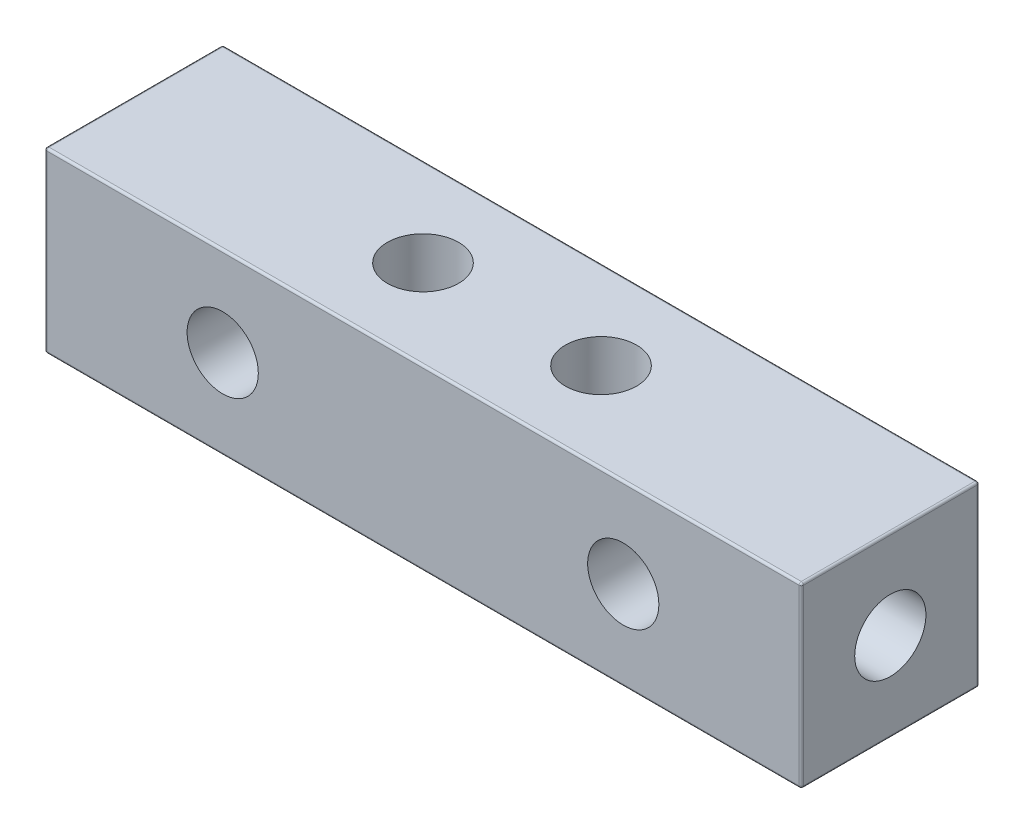
from build123d import *

# Parameters (mm, degrees)
SKETCH_1_W          = 8
SKETCH_1_H          = 8
EXTRUDE_1_DEPTH     = 34
FILLET_1_R          = 0.1
SKETCH_2_R          = 1.6
CUT_EXTRUDE_1_DEPTH = 35.467375879
SKETCH_3_R          = 1.6
CUT_EXTRUDE_2_DEPTH = 36.156791662
SKETCH_4_R          = 1.6
CUT_EXTRUDE_3_DEPTH = 36.156791662


with BuildPart() as part:
    # 草图1 → 凸台-拉伸1 (new body)
    with BuildSketch(Plane(origin=(0, 0, 0), x_dir=(0, 0, -1), z_dir=(1, 0, 0))):
        Rectangle(SKETCH_1_W, SKETCH_1_H)
    extrude(amount=EXTRUDE_1_DEPTH)

    # 圆角1
    fillet_1_edges = [part.edges().sort_by_distance(p)[0] for p in [
        (34, 0, 4),
        (34, -4, 0),
        (34, 0, -4),
        (0, -4, 0),
        (0, 0, 4),
        (0, 4, 0),
        (0, 0, -4),
        (17, -4, -4),
        (17, -4, 4),
        (17, 4, 4),
        (17, 4, -4),
        (34, 4, 0),
    ]]
    fillet(fillet_1_edges, radius=FILLET_1_R)

    # 草图2 → 切除-拉伸1 (cut, through all)
    with BuildSketch(Plane.ZY):
        Circle(SKETCH_2_R)
    extrude(amount=-CUT_EXTRUDE_1_DEPTH, mode=Mode.SUBTRACT)

    # 草图3 → 切除-拉伸2 (cut, through all)
    with BuildSketch(Plane.XY.offset(4)):
        with Locations((8, 0)):
            Circle(SKETCH_3_R)
        with Locations((26, 0)):
            Circle(SKETCH_3_R)
    extrude(amount=-CUT_EXTRUDE_2_DEPTH, mode=Mode.SUBTRACT)

    # 草图4 → 切除-拉伸3 (cut, through all)
    with BuildSketch(Plane(origin=(0, 4, 0), x_dir=(1, 0, 0), z_dir=(0, 1, 0))):
        with Locations(Location((21, 0, 0), (0, 0, 270))):
            Circle(SKETCH_4_R)
        with Locations(Location((13, 0, 0), (0, 0, 270))):
            Circle(SKETCH_4_R)
    extrude(amount=-CUT_EXTRUDE_3_DEPTH, mode=Mode.SUBTRACT)


solid = part.part
